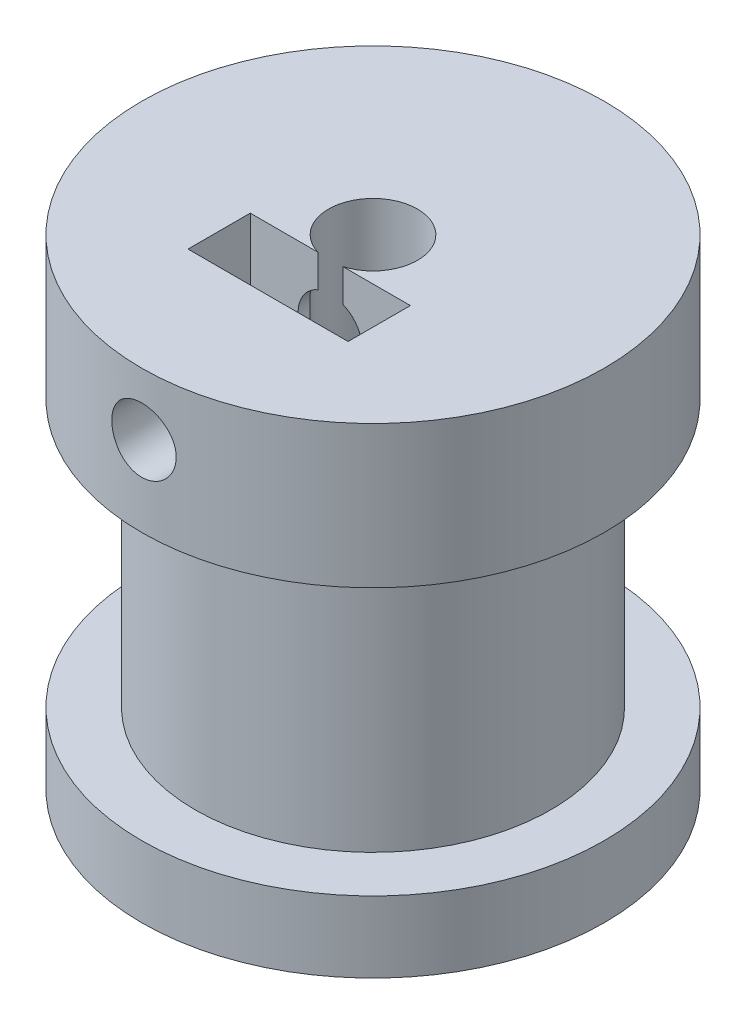
from build123d import *

# Parameters (mm, degrees)
SKETCH1_R           = 10
SKETCH1_R_2         = 2.5
BOSS_EXTRUDE1_DEPTH = 7.5
BOSS_EXTRUDE2_START = 15.5
SKETCH2_R           = 13
SKETCH2_R_2         = 10
SKETCH2_R_3         = 2.5
BOSS_EXTRUDE2_DEPTH = 8
BOSS_EXTRUDE3_START = -7.5
SKETCH2_4_R         = 13
SKETCH2_4_R_2       = 10
SKETCH2_4_R_3       = 2.5
BOSS_EXTRUDE3_DEPTH = 4
SKETCH4_W           = 9
SKETCH4_H           = 3.5
CUT_EXTRUDE5_DEPTH  = 12
SKETCH5_R           = 1.81
CUT_EXTRUDE7_DEPTH  = 25.046829313


with BuildPart() as part:
    # Sketch1 → Boss-Extrude1 (new, symmetric)
    with BuildSketch(Plane(origin=(0, 0, 0), x_dir=(1, 0, 0), z_dir=(0, 1, 0))):
        with Locations(Location((0, 0, 0), (0, 0, 270))):
            Circle(SKETCH1_R)
        with Locations(Location((0, 0, 0), (0, 0, 270))):
            Circle(SKETCH1_R_2, mode=Mode.SUBTRACT)
    extrude(amount=BOSS_EXTRUDE1_DEPTH, both=True)

    # Sketch2 → Boss-Extrude2 (add)
    # profile 1 of 2: a face of its own
    with BuildSketch(Plane(origin=(0, 0, 0), x_dir=(1, 0, 0), z_dir=(0, 1, 0)).offset(BOSS_EXTRUDE2_START)):
        with Locations(Location((0, 0, 0), (0, 0, 270))):
            Circle(SKETCH2_R)
        with Locations(Location((0, 0, 0), (0, 0, 270))):
            Circle(SKETCH2_R_2, mode=Mode.SUBTRACT)
    # profile 2 of 2: a face of its own
    with BuildSketch(Plane(origin=(0, 0, 0), x_dir=(1, 0, 0), z_dir=(0, 1, 0)).offset(BOSS_EXTRUDE2_START)):
        with Locations(Location((0, 0, 0), (0, 0, 270))):
            Circle(SKETCH2_R_2)
        with Locations(Location((0, 0, 0), (0, 0, 270))):
            Circle(SKETCH2_R_3, mode=Mode.SUBTRACT)
    extrude(amount=-BOSS_EXTRUDE2_DEPTH)

    # Sketch2<4> → Boss-Extrude3 (add)
    # profile 1 of 2: a face of its own
    with BuildSketch(Plane(origin=(0, 0, 0), x_dir=(1, 0, 0), z_dir=(0, 1, 0)).offset(BOSS_EXTRUDE3_START)):
        with Locations(Location((0, 0, 0), (0, 0, 270))):
            Circle(SKETCH2_4_R)
        with Locations(Location((0, 0, 0), (0, 0, 270))):
            Circle(SKETCH2_4_R_2, mode=Mode.SUBTRACT)
    # profile 2 of 2: a face of its own
    with BuildSketch(Plane(origin=(0, 0, 0), x_dir=(1, 0, 0), z_dir=(0, 1, 0)).offset(BOSS_EXTRUDE3_START)):
        with Locations(Location((0, 0, 0), (0, 0, 270))):
            Circle(SKETCH2_4_R_2)
        with Locations(Location((0, 0, 0), (0, 0, 270))):
            Circle(SKETCH2_4_R_3, mode=Mode.SUBTRACT)
    extrude(amount=-BOSS_EXTRUDE3_DEPTH)

    # Sketch4 → Cut-Extrude5 (cut)
    with BuildSketch(Plane(origin=(0, 15.5, 0), x_dir=(1, 0, 0), z_dir=(0, 1, 0))):
        with Locations((0, -4.15)):
            Rectangle(SKETCH4_W, SKETCH4_H)
    extrude(amount=-CUT_EXTRUDE5_DEPTH, mode=Mode.SUBTRACT)

    # Sketch5 → Cut-Extrude7 (cut, through all)
    with BuildSketch(Plane.XY):
        with Locations(Location((0, 12, 0), (0, 0, 90))):
            Circle(SKETCH5_R)
    extrude(amount=CUT_EXTRUDE7_DEPTH, mode=Mode.SUBTRACT)


solid = part.part
